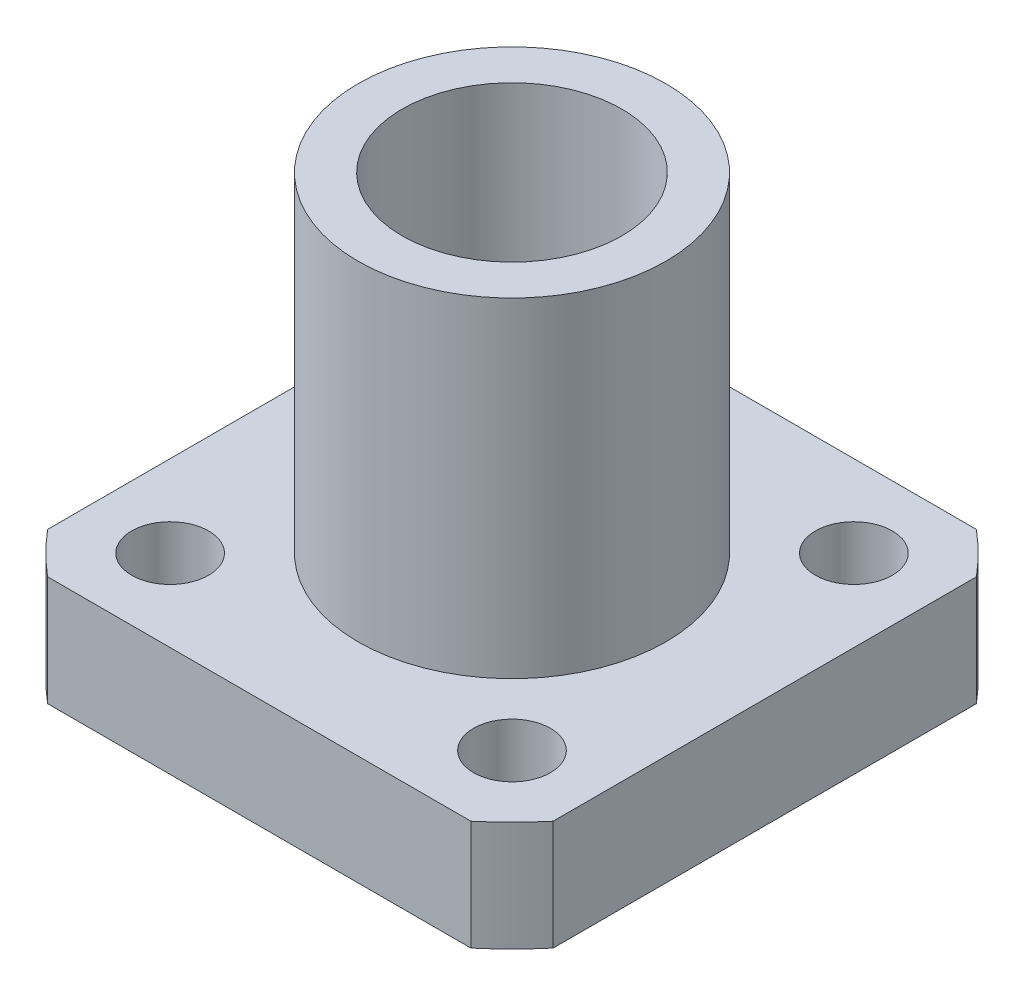
from build123d import *

# Parameters (mm, degrees)
SKETCH1_R           = 1.75
BOSS_EXTRUDE1_DEPTH = 5
SKETCH2_R           = 7
BOSS_EXTRUDE2_DEPTH = 15
SKETCH3_R           = 5
CUT_EXTRUDE1_DEPTH  = 26.777897509


with BuildPart() as part:
    # Sketch1 → Boss-Extrude1 (new body)
    with BuildSketch(Plane(origin=(0, 0, 0), x_dir=(1, 0, 0), z_dir=(0, 1, 0))):
        with BuildLine():
            Line((-9.630680142, -11.5), (9.630680142, -11.5))
            ThreePointArc((9.630680142, -11.5), (10.606601718, -10.606601718), (11.5, -9.630680142))
            Line((11.5, -9.630680142), (11.5, 9.630680142))
            ThreePointArc((11.5, 9.630680142), (10.606601718, 10.606601718), (9.630680142, 11.5))
            Line((9.630680142, 11.5), (-9.630680142, 11.5))
            ThreePointArc((-9.630680142, 11.5), (-10.606601718, 10.606601718), (-11.5, 9.630680142))
            Line((-11.5, 9.630680142), (-11.5, -9.630680142))
            ThreePointArc((-11.5, -9.630680142), (-10.606601718, -10.606601718), (-9.630680142, -11.5))
        make_face()
        with Locations(Location((-7.778174593, 7.778174593, 0), (0, 0, 270))):
            Circle(SKETCH1_R, mode=Mode.SUBTRACT)
        with Locations(Location((7.778174593, 7.778174593, 0), (0, 0, 270))):
            Circle(SKETCH1_R, mode=Mode.SUBTRACT)
        with Locations(Location((-7.778174593, -7.778174593, 0), (0, 0, 270))):
            Circle(SKETCH1_R, mode=Mode.SUBTRACT)
        with Locations(Location((7.778174593, -7.778174593, 0), (0, 0, 270))):
            Circle(SKETCH1_R, mode=Mode.SUBTRACT)
    extrude(amount=BOSS_EXTRUDE1_DEPTH)

    # Sketch2 → Boss-Extrude2 (add)
    with BuildSketch(Plane(origin=(0, 5, 0), x_dir=(1, 0, 0), z_dir=(0, 1, 0))):
        with Locations(Location((0, 0, 0), (0, 0, 270))):
            Circle(SKETCH2_R)
    extrude(amount=BOSS_EXTRUDE2_DEPTH)

    # Sketch3 → Cut-Extrude1 (cut, through all)
    with BuildSketch(Plane(origin=(0, 20, 0), x_dir=(1, 0, 0), z_dir=(0, 1, 0))):
        with Locations(Location((0, 0, 0), (0, 0, 270))):
            Circle(SKETCH3_R)
    extrude(amount=-CUT_EXTRUDE1_DEPTH, mode=Mode.SUBTRACT)


solid = part.part
